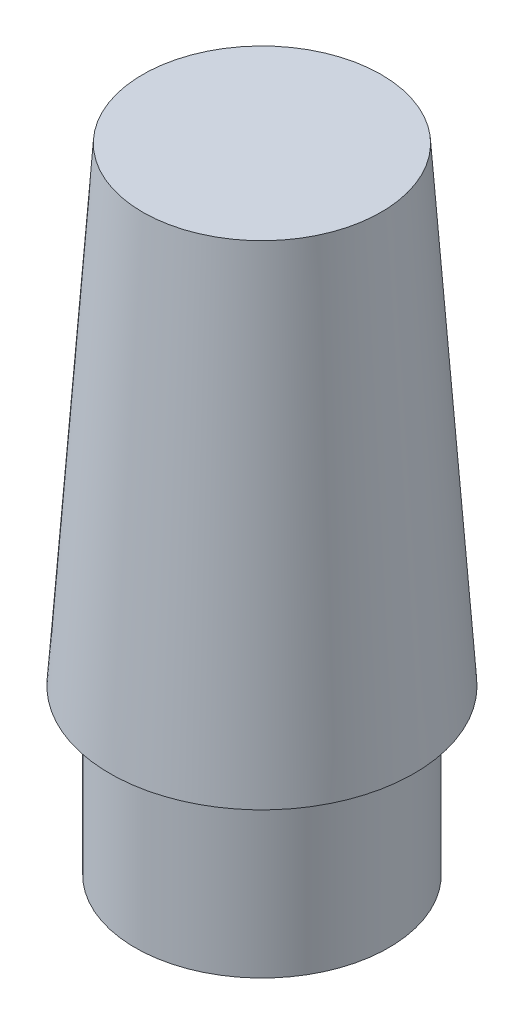
from build123d import *

# Parameters (mm, degrees)
SKETCH1_R           = 15.35
BOSS_EXTRUDE1_DEPTH = 63.9
SKETCH2_R           = 15.35
CUT_EXTRUDE1_DEPTH  = 16.5
DRAFT3_ANGLE        = -4


with BuildPart() as part:
    # Sketch1 → Boss-Extrude1 (new body)
    with BuildSketch(Plane(origin=(0, 0, 0), x_dir=(1, 0, 0), z_dir=(0, 1, 0))):
        with Locations(Location((0, 0, 0), (0, 0, 270))):
            Circle(SKETCH1_R)
    extrude(amount=BOSS_EXTRUDE1_DEPTH)

    # Sketch2 → Cut-Extrude1 (cut)
    with BuildSketch(Plane.XZ):
        with Locations(Location((0, 0, 0), (0, 0, 270))):
            Circle(SKETCH2_R)
        with BuildLine():
            Line((-10.8, -6.870225615), (-10.8, 6.870225615))
            ThreePointArc((-10.8, 6.870225615), (12.8, 0), (-10.8, -6.870225615))
        make_face(mode=Mode.SUBTRACT)
    extrude(amount=-CUT_EXTRUDE1_DEPTH, mode=Mode.SUBTRACT)

    # Draft3
    draft3_faces = [part.faces().sort_by_distance(p)[0] for p in [
        (0, 40.2, -15.35),
    ]]
    draft(draft3_faces, Plane(origin=(0, 16.5, 0), x_dir=(0, 0, -1), z_dir=(0, -1, 0)), DRAFT3_ANGLE)


solid = part.part
